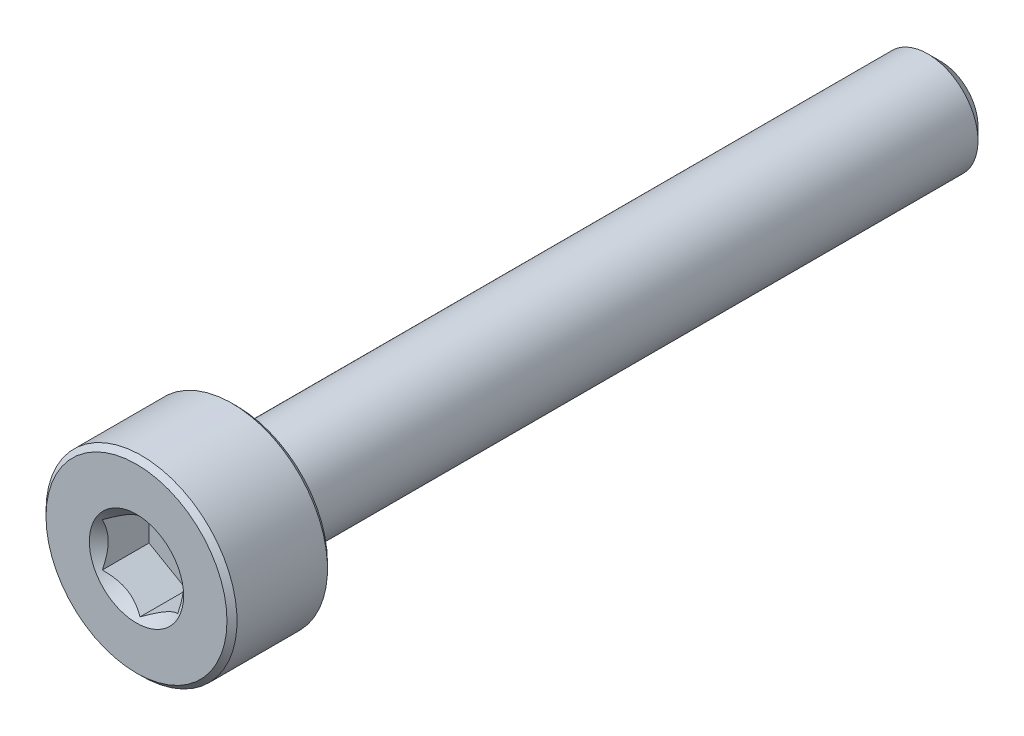
from build123d import *

# Parameters (mm, degrees)
CUT_EXTRUDE1_DEPTH = 1


with BuildPart() as part:
    # Sketch2 → Revolve1 (revolve)
    with BuildSketch(Plane(origin=(0, 0, 0), x_dir=(0, 0, -1), z_dir=(1, 0, 0)), mode=Mode.PRIVATE) as revolve1_sk:
        with BuildLine():
            Line((-8, 0), (-8, 1.8))
            Line((-8, 1.8), (-7.9, 1.9))
            Line((-7.9, 1.9), (-6.1, 1.9))
            Line((-6.1, 1.9), (-6, 1.8))
            Line((-6, 1.8), (-6, 1.2))
            ThreePointArc((-6, 1.2), (-5.941421356, 1.058578644), (-5.8, 1))
            Line((-5.8, 1), (7.740192379, 1))
            Line((7.740192379, 1), (8, 0.740192379))
            Line((8, 0.740192379), (8, 0))
            Line((8, 0), (-8, 0))
        make_face()
    revolve(revolve1_sk.sketch.rotate(Axis((0, 0, -8), (0, 0, 1)), 90), axis=Axis((0, 0, -8), (0, 0, 1)))

    # Sketch3 → Cut-Extrude1 (cut)
    with BuildSketch(Plane.XY.offset(8)):
        Polygon((0.75, -0.433012702), (0.75, 0.433012702), (0, 0.866025404), (-0.75, 0.433012702), (-0.75, -0.433012702), (0, -0.866025404), align=None)
    extrude(amount=-CUT_EXTRUDE1_DEPTH, mode=Mode.SUBTRACT)

    # Cut-Extrude2 cone 1 section (through the dimple's axis) → Cut-Extrude2 (revolve, cut)
    with BuildSketch(Plane(origin=(0, 0, 8), x_dir=(0, -1, 0), z_dir=(1, 0, 0))):
        Polygon((0, 0), (0.9375, 0), (0, 0.9375), align=None)
    revolve(axis=Axis((0, 0, 8), (0, 0, -1)), mode=Mode.SUBTRACT)


solid = part.part
